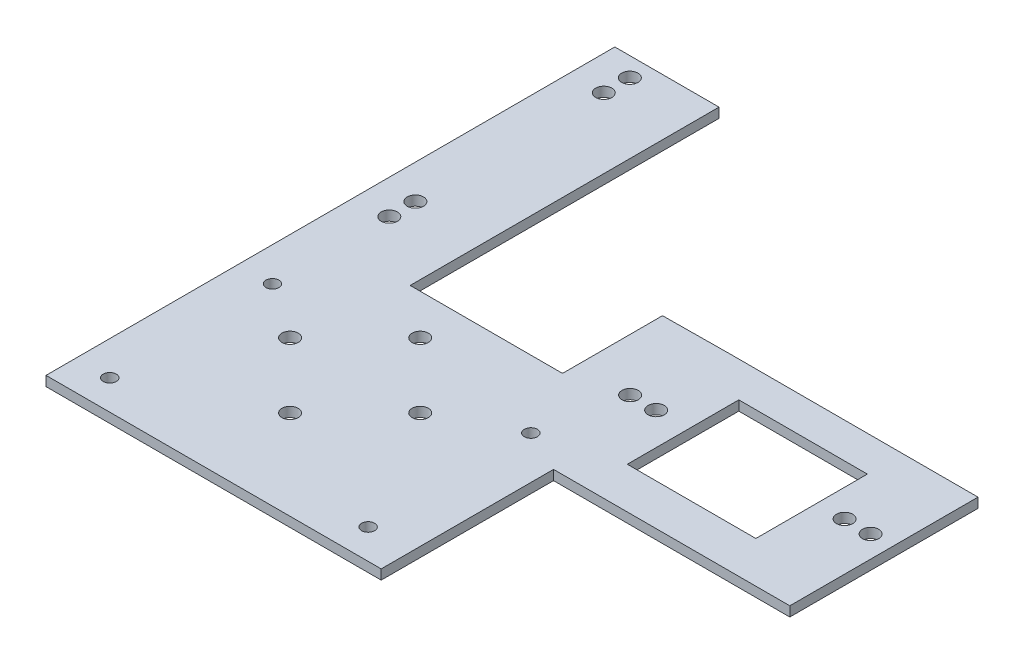
from build123d import *

# Parameters (mm, degrees)
SKETCH1_R           = 2.5
SKETCH1_W           = 39.504270757
SKETCH1_H           = 34.26660973
BOSS_EXTRUDE1_DEPTH = 3
SKETCH4_R           = 2
CUT_EXTRUDE3_DEPTH  = 10


with BuildPart() as part:
    # Sketch1 → Boss-Extrude1 (new body)
    with BuildSketch(Plane(origin=(0, 0, 0), x_dir=(1, 0, 0), z_dir=(0, 1, 0))):
        Polygon((-100, 76.642236505), (-100, -98.157625791), (3, -98.157625791), (3, -45.195936932), (75.604056887, -45.195936932), (75.604056887, 12.636866249), (-0.5895682, 12.636866249), (-21.164811555, 12.447038184), (-21.164811555, -18.271243478), (-67.980697631, -18.271243478), (-67.980697631, 12.636866249), (-67.980697631, 76.642236505), align=None)
        with Locations(Location((-52.5, -70.657625791, 0), (0, 0, 270))):
            Circle(SKETCH1_R, mode=Mode.SUBTRACT)
        with Locations(Location((-72.5, -50.657625791, 0), (0, 0, 270))):
            Circle(SKETCH1_R, mode=Mode.SUBTRACT)
        with Locations(Location((-52.5, -30.657625791, 0), (0, 0, 270))):
            Circle(SKETCH1_R, mode=Mode.SUBTRACT)
        with Locations(Location((-32.5, -50.657625791, 0), (0, 0, 270))):
            Circle(SKETCH1_R, mode=Mode.SUBTRACT)
        with Locations(Location((-5, -13.657625791, 0), (0, 0, 270))):
            Circle(SKETCH1_R, mode=Mode.SUBTRACT)
        with Locations(Location((60.9, -13.657625791, 0), (0, 0, 270))):
            Circle(SKETCH1_R, mode=Mode.SUBTRACT)
        with Locations(Location((-89.5, -3.157625791, 0), (0, 0, 270))):
            Circle(SKETCH1_R, mode=Mode.SUBTRACT)
        with Locations(Location((-89.5, 62.742374209, 0), (0, 0, 270))):
            Circle(SKETCH1_R, mode=Mode.SUBTRACT)
        with Locations(Location((-89.5, 4.842374209, 0), (0, 0, 270))):
            Circle(SKETCH1_R, mode=Mode.SUBTRACT)
        with Locations(Location((-89.5, 70.742374209, 0), (0, 0, 270))):
            Circle(SKETCH1_R, mode=Mode.SUBTRACT)
        with Locations(Location((3, -13.657625791, 0), (0, 0, 270))):
            Circle(SKETCH1_R, mode=Mode.SUBTRACT)
        with Locations(Location((68.9, -13.657625791, 0), (0, 0, 270))):
            Circle(SKETCH1_R, mode=Mode.SUBTRACT)
        with Locations((32.721465803, -15.366695135)):
            Rectangle(SKETCH1_W, SKETCH1_H, mode=Mode.SUBTRACT)
    extrude(amount=BOSS_EXTRUDE1_DEPTH)

    # Sketch4 → Cut-Extrude3 (cut)
    with BuildSketch(Plane(origin=(0, 3, 0), x_dir=(1, 0, 0), z_dir=(0, 1, 0))):
        with Locations((-63.221437818, -7.837794837)):
            Circle(SKETCH4_R)
        with Locations((-26.595771041, -7.837794837)):
            Circle(SKETCH4_R)
        with Locations(Location((-89.563443469, -89.007054179, 0), (0, 0, 270))):
            Circle(SKETCH4_R)
        with Locations(Location((-10.164633565, -89.007054179, 0), (0, 0, 270))):
            Circle(SKETCH4_R)
        with Locations(Location((-10.164633565, -39.007054179, 0), (0, 0, 270))):
            Circle(SKETCH4_R)
        with Locations(Location((-89.563443469, -39.007054179, 0), (0, 0, 270))):
            Circle(SKETCH4_R)
    extrude(amount=-CUT_EXTRUDE3_DEPTH, mode=Mode.SUBTRACT)


solid = part.part
